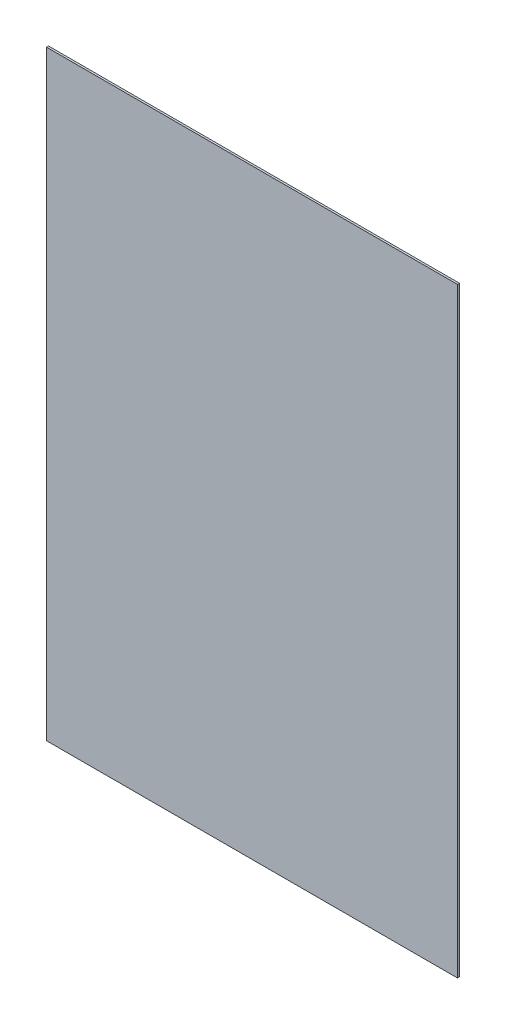
from build123d import *

# Parameters (mm, degrees)
SKETCH2_W           = 649.53
SKETCH2_H           = 949.53
BOSS_EXTRUDE1_DEPTH = 3.175


with BuildPart() as part:
    # Sketch2 → Boss-Extrude1 (new body)
    with BuildSketch(Plane.XY):
        Rectangle(SKETCH2_W, SKETCH2_H)
    extrude(amount=BOSS_EXTRUDE1_DEPTH)


solid = part.part
